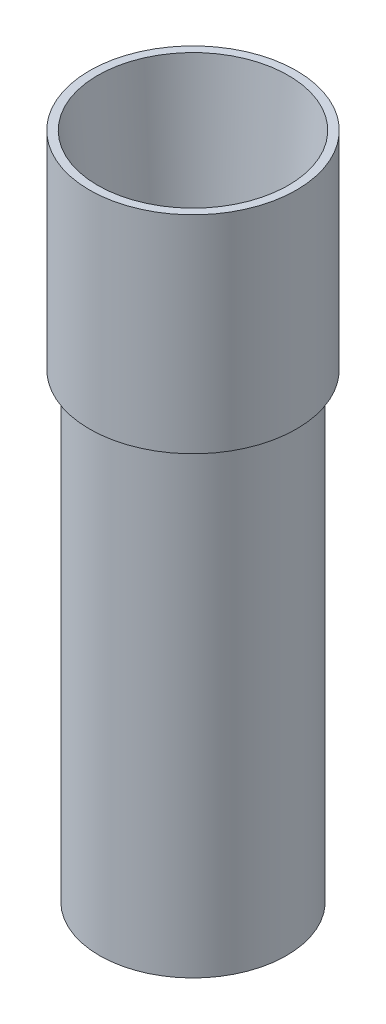
from build123d import *

# Parameters (mm, degrees)
SKETCH1_R           = 12.7
BOSS_EXTRUDE1_DEPTH = 82
SKETCH2_R           = 11.7
CUT_EXTRUDE1_DEPTH  = 25.4
CUT_EXTRUDE1_DRAFT  = -5
SKETCH3_R           = 9.477787946
CUT_EXTRUDE2_DEPTH  = 53.38
SKETCH5_OUTSIDE_W   = 45.304
SKETCH5_OUTSIDE_H   = 45.304
SKETCH5_OUTSIDE_R   = 11.477787946
CUT_EXTRUDE4_DEPTH  = 60.374839676


with BuildPart() as part:
    # Sketch1 → Boss-Extrude1 (new body)
    with BuildSketch(Plane(origin=(0, 0, 0), x_dir=(1, 0, 0), z_dir=(0, 1, 0))):
        with Locations(Location((0, 0, 0), (0, 0, 270))):
            Circle(SKETCH1_R)
    extrude(amount=-BOSS_EXTRUDE1_DEPTH)


with BuildPart() as cut_extrude1_tool:
    # Sketch2 → Cut-Extrude1 (with draft: the straight prism first)
    with BuildSketch(Plane(origin=(0, 0, 0), x_dir=(1, 0, 0), z_dir=(0, 1, 0))):
        Circle(SKETCH2_R)
    extrude(amount=-CUT_EXTRUDE1_DEPTH)
    # Cut-Extrude1: the draft: its side faces are tilted about the plane it starts from
    cut_extrude1_sides = [cut_extrude1_tool.faces().sort_by_distance(p)[0] for p in [
        (-11.7, -12.7, 0),
    ]]
    draft(cut_extrude1_sides, Plane(origin=(0, 0, 0), x_dir=(1, 0, 0), z_dir=(0, 1, 0)), CUT_EXTRUDE1_DRAFT)


with BuildPart() as part_1:
    add(part.part)

    # Cut-Extrude1: cut by cut_extrude1_tool
    add(cut_extrude1_tool.part, mode=Mode.SUBTRACT)

    # Sketch3 → Cut-Extrude2 (cut)
    with BuildSketch(Plane(origin=(0, -25.4, 0), x_dir=(1, 0, 0), z_dir=(0, 1, 0))):
        with Locations(Location((0, 0, 0), (0, 0, 270))):
            Circle(SKETCH3_R)
    extrude(amount=-CUT_EXTRUDE2_DEPTH, mode=Mode.SUBTRACT)

    # Sketch5 outside → Cut-Extrude4 (cut, through all)
    with BuildSketch(Plane(origin=(0, -25.406788512, 0), x_dir=(1, 0, 0), z_dir=(0, 1, 0))):
        Rectangle(SKETCH5_OUTSIDE_W, SKETCH5_OUTSIDE_H)
        with Locations(Location((0, 0, 0), (0, 0, 270))):
            Circle(SKETCH5_OUTSIDE_R, mode=Mode.SUBTRACT)
    extrude(amount=-CUT_EXTRUDE4_DEPTH, mode=Mode.SUBTRACT)


solid = part_1.part
